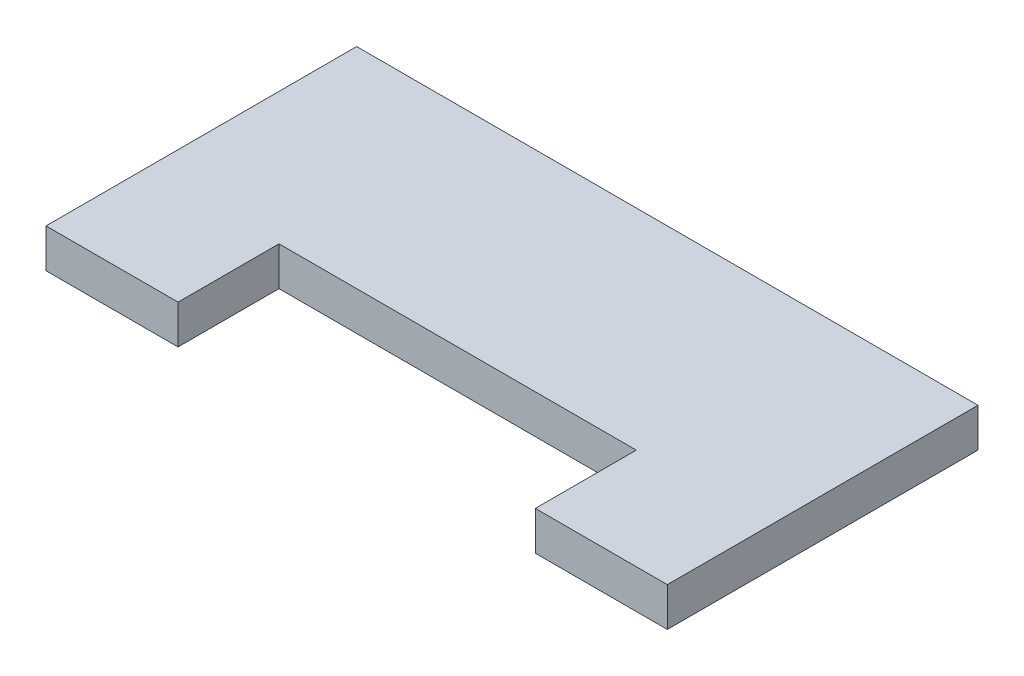
from build123d import *

# Parameters (mm, degrees)
BOSS_EXTRUDE1_DEPTH = 5


with BuildPart() as part:
    # Sketch1 → Boss-Extrude1 (new body)
    with BuildSketch(Plane(origin=(0, 0, 0), x_dir=(1, 0, 0), z_dir=(0, 1, 0))):
        Polygon((-17, 0), (0, 0), (0, 40), (-80, 40), (-80, 0), (-63, 0), (-63, 13), (-17, 13), align=None)
    extrude(amount=BOSS_EXTRUDE1_DEPTH)


solid = part.part
